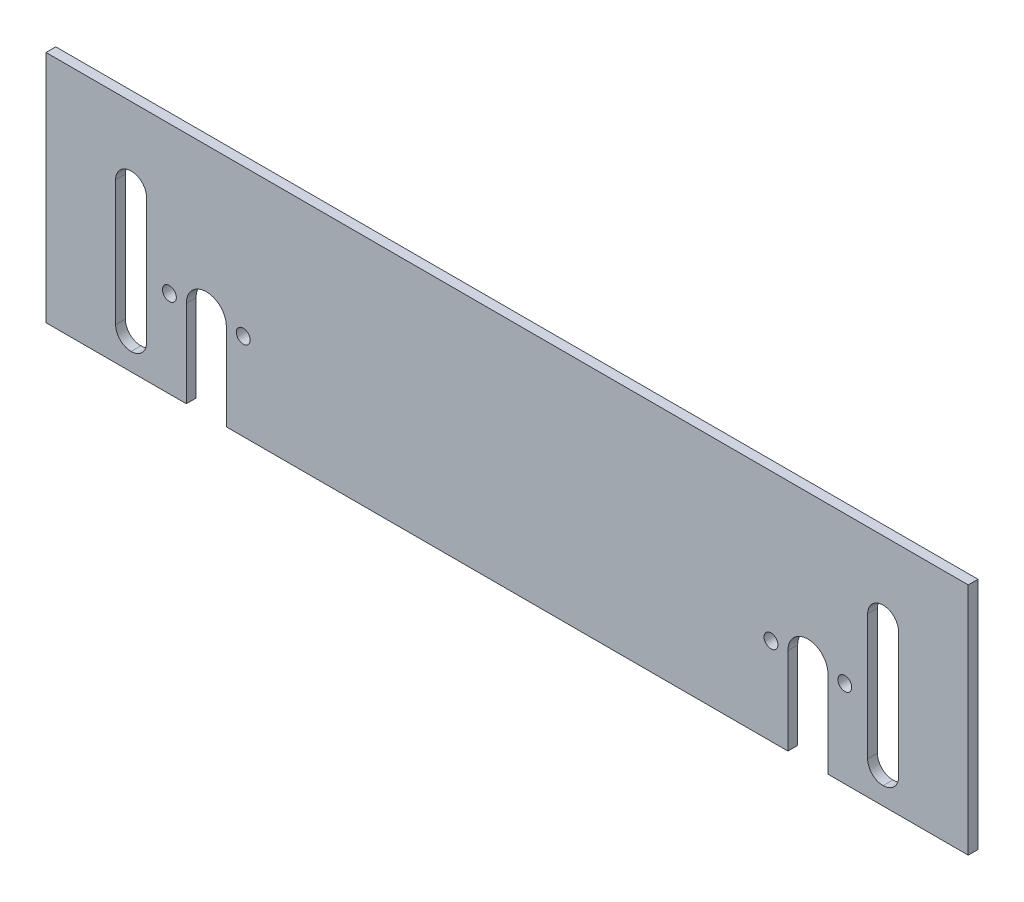
from build123d import *

# Parameters (mm, degrees)
SKETCH1_W            = 299.7
SKETCH1_H            = 76.075
BOSS_EXTRUDE1_DEPTH  = 3.175
CUT_EXTRUDE4_DEPTH   = 155.634907221
SKETCH3_R            = 6.5
CUT_EXTRUDE5_DEPTH   = 155.634907221
M4_CLEARANCE_HOLE1_D = 4.5


with BuildPart() as part:
    # Sketch1 → Boss-Extrude1 (new body)
    with BuildSketch(Plane.XY):
        Rectangle(SKETCH1_W, SKETCH1_H)
    extrude(amount=BOSS_EXTRUDE1_DEPTH)

    # Sketch8 → Cut-Extrude4 (cut, through all)
    with BuildSketch(Plane.XY.offset(3.175)):
        with BuildLine():
            Line((122.1609, 18.5125), (122.2247, 18.5125))
            ThreePointArc((122.2247, 18.5125), (125.760233906, 17.048033906), (127.2247, 13.5125))
            Line((127.2247, 13.5125), (127.2247, -27.282435401))
            ThreePointArc((127.2247, -27.282435401), (125.760233906, -30.817969307), (122.2247, -32.282435401))
            Line((122.2247, -32.282435401), (122.1609, -32.282435401))
            ThreePointArc((122.1609, -32.282435401), (118.625366094, -30.817969307), (117.1609, -27.282435401))
            Line((117.1609, -27.282435401), (117.1609, 13.5125))
            ThreePointArc((117.1609, 13.5125), (118.625366094, 17.048033906), (122.1609, 18.5125))
        make_face()
    cut_extrude4 = extrude(amount=-CUT_EXTRUDE4_DEPTH, mode=Mode.SUBTRACT)

    # Mirror3: Cut-Extrude4 across plane
    add(cut_extrude4.mirror(Plane(origin=(0, 0, 0), x_dir=(0, 0, 1), z_dir=(1, 0, 0))), mode=Mode.SUBTRACT)

    # Sketch3 → Cut-Extrude5 (cut, through all)
    with BuildSketch(Plane(origin=(0, 0, 0), x_dir=(-1, 0, 0), z_dir=(0, 0, -1))):
        with Locations((-97.75, -9.7625)):
            Circle(SKETCH3_R)
        with BuildLine():
            Line((-104.25, -38.0375), (-91.25, -38.0375))
            Line((-91.25, -38.0375), (-91.25, -9.7625))
            ThreePointArc((-91.25, -9.7625), (-97.75, -16.2625), (-104.25, -9.7625))
            Line((-104.25, -9.7625), (-104.25, -38.0375))
        make_face()
        with Locations((97.75, -9.7625)):
            Circle(SKETCH3_R)
        with BuildLine():
            Line((91.25, -38.0375), (104.25, -38.0375))
            Line((104.25, -38.0375), (104.25, -9.7625))
            ThreePointArc((104.25, -9.7625), (97.75, -16.2625), (91.25, -9.7625))
            Line((91.25, -9.7625), (91.25, -38.0375))
        make_face()
    extrude(amount=-CUT_EXTRUDE5_DEPTH, mode=Mode.SUBTRACT)

    # M4 Clearance Hole1 (through all)
    with Locations(Plane(origin=(0, 0, 0), x_dir=(-1, 0, 0), z_dir=(0, 0, -1))):
        with Locations((-85.75, -9.7625), (-109.75, -9.7625), (109.75, -9.7625), (85.75, -9.7625)):
            Hole(M4_CLEARANCE_HOLE1_D / 2)


solid = part.part
